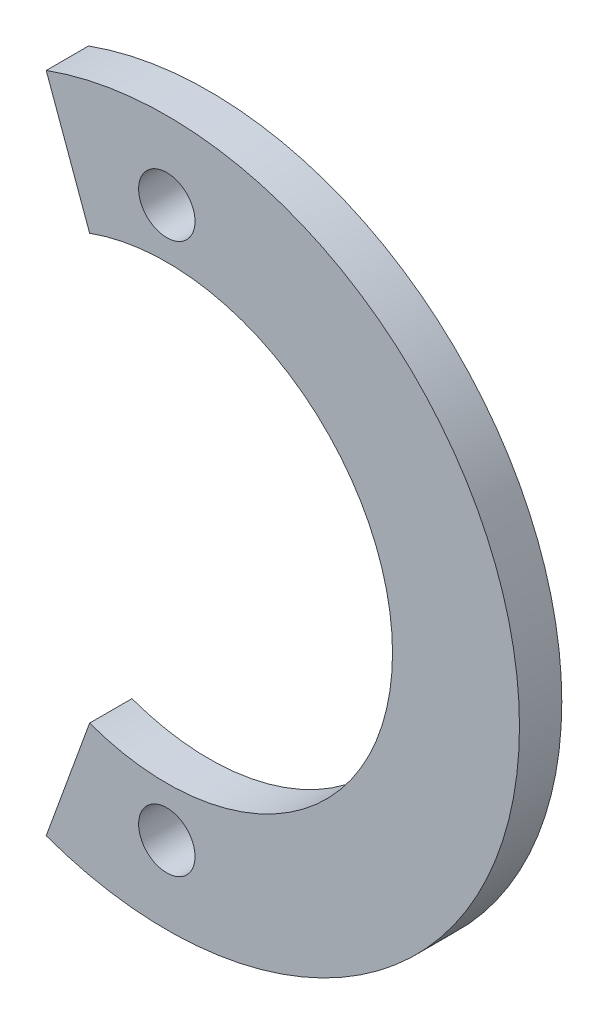
from build123d import *

# Parameters (mm, degrees)
SALIENTE_EXTRUIR1_DEPTH = 3
CROQUIS2_R              = 2
CORTAR_EXTRUIR1_DEPTH   = 3


with BuildPart() as part:
    # Croquis1 → Saliente-Extruir1 (new body)
    with BuildSketch(Plane.XY):
        with BuildLine():
            ThreePointArc((16, 0), (9.177222982, -13.106432709), (-5.472322293, -15.035081933))
            Line((-5.472322293, -15.035081933), (-8.550503583, -23.49231552))
            ThreePointArc((-8.550503583, -23.49231552), (14.339410909, -20.478801107), (25, 0))
            ThreePointArc((25, 0), (14.339410909, 20.478801107), (-8.550503583, 23.49231552))
            Line((-8.550503583, 23.49231552), (-5.472322293, 15.035081933))
            ThreePointArc((-5.472322293, 15.035081933), (9.177222982, 13.106432709), (16, 0))
        make_face()
    extrude(amount=SALIENTE_EXTRUIR1_DEPTH)

    # Croquis2 → Cortar-Extruir1 (cut)
    with BuildSketch(Plane(origin=(0, 0, 0), x_dir=(-1, 0, 0), z_dir=(0, 0, -1))):
        with Locations((0, -19.5)):
            Circle(CROQUIS2_R)
        with Locations(Location((0, 19.5, 0), (0, 0, 180))):
            Circle(CROQUIS2_R)
    extrude(amount=-CORTAR_EXTRUIR1_DEPTH, mode=Mode.SUBTRACT)


solid = part.part
